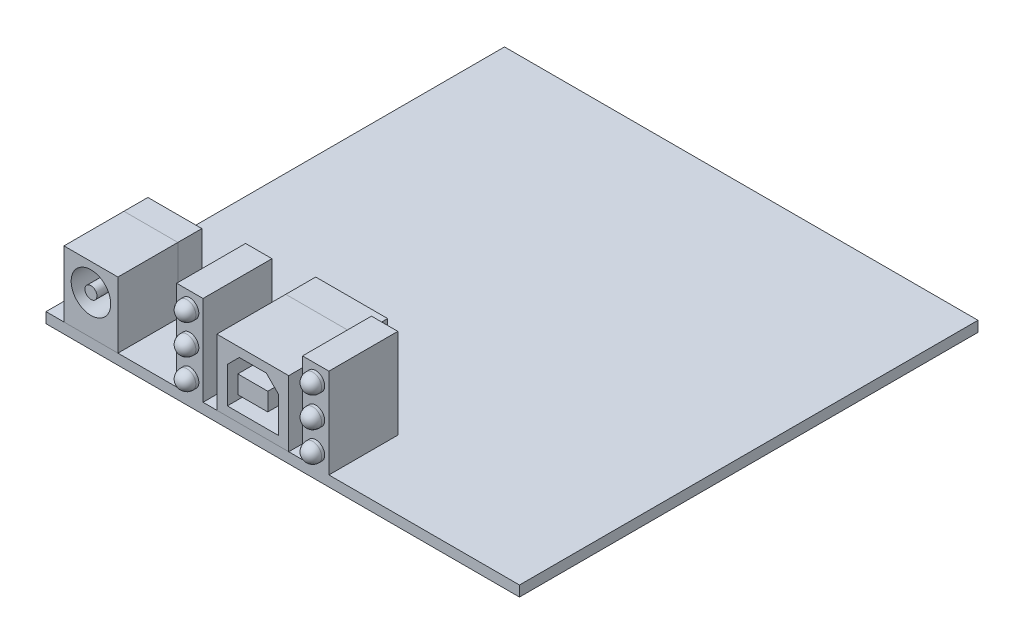
from build123d import *

# Parameters (mm, degrees)
SKETCH1_W             = 79
SKETCH1_H             = 76.5
BOSS_EXTRUDE1_DEPTH   = 1.75
SKETCH2_W             = 9
SKETCH2_H             = 11
SKETCH2_R             = 3.3
BOSS_EXTRUDE2_DEPTH   = 10
SKETCH2_R_2           = 1
BOSS_EXTRUDE2_2_DEPTH = 10
SKETCH3_W             = 9
SKETCH3_H             = 11
BOSS_EXTRUDE3_DEPTH   = 4
SKETCH4_W             = 12
SKETCH4_H             = 11
BOSS_EXTRUDE4_DEPTH   = 11.5
SKETCH4_W_2           = 4.4
SKETCH4_H_2           = 15
BOSS_EXTRUDE4_2_DEPTH = 11.5
BOSS_EXTRUDE4_3_DEPTH = 11.5
SKETCH4_W_3           = 5
SKETCH4_H_3           = 3
BOSS_EXTRUDE4_4_DEPTH = 11.5
SKETCH5_W             = 12
SKETCH5_H             = 11
BOSS_EXTRUDE5_DEPTH   = 5
SKETCH6_R             = 1.5
BOSS_EXTRUDE6_DEPTH   = 2
FILLET1_R             = 1.5


with BuildPart() as part:
    # Sketch1 → Boss-Extrude1 (new body)
    with BuildSketch(Plane(origin=(0, 0, 0), x_dir=(1, 0, 0), z_dir=(0, 1, 0))):
        Rectangle(SKETCH1_W, SKETCH1_H)
    extrude(amount=BOSS_EXTRUDE1_DEPTH)



with BuildPart() as body_2:
    # Sketch2 → Boss-Extrude2 (new body)
    with BuildSketch(Plane.XY.offset(38.25)):
        with Locations((-32, 7.25)):
            Rectangle(SKETCH2_W, SKETCH2_H)
        with Locations((-32, 8.25)):
            Circle(SKETCH2_R, mode=Mode.SUBTRACT)
    extrude(amount=-BOSS_EXTRUDE2_DEPTH)


with BuildPart() as body_3:
    # Sketch2 → Boss-Extrude2 2 (new body)
    with BuildSketch(Plane.XY.offset(38.25)):
        with Locations((-32, 8.25)):
            Circle(SKETCH2_R_2)
    extrude(amount=-BOSS_EXTRUDE2_2_DEPTH)


with BuildPart() as part_1:
    add(part.part)

    add(body_3.part)  # Boss-Extrude3 merges body 3
    # Sketch3 → Boss-Extrude3 (add)
    with BuildSketch(Plane(origin=(0, 0, 28.25), x_dir=(-1, 0, 0), z_dir=(0, 0, -1))):
        with Locations((32, 7.25)):
            Rectangle(SKETCH3_W, SKETCH3_H)
    extrude(amount=BOSS_EXTRUDE3_DEPTH)



with BuildPart() as body_3_2:
    # Sketch4 → Boss-Extrude4 (new body)
    with BuildSketch(Plane.XY.offset(38.25)):
        with Locations((-5, 7.25)):
            Rectangle(SKETCH4_W, SKETCH4_H)
        Polygon((-9.25, 3.25), (-9.25, 9.25), (-7.25, 11.25), (-2.75, 11.25), (-0.75, 9.25), (-0.75, 3.25), align=None, mode=Mode.SUBTRACT)
    extrude(amount=-BOSS_EXTRUDE4_DEPTH)


with BuildPart() as body_4:
    # Sketch4 → Boss-Extrude4 2 (new body)
    with BuildSketch(Plane.XY.offset(38.25)):
        with Locations((-15.5, 9.25)):
            Rectangle(SKETCH4_W_2, SKETCH4_H_2)
    extrude(amount=-BOSS_EXTRUDE4_2_DEPTH)


with BuildPart() as body_5:
    # Sketch4 → Boss-Extrude4 3 (new body)
    with BuildSketch(Plane.XY.offset(38.25)):
        with Locations((5.5, 9.25)):
            Rectangle(SKETCH4_W_2, SKETCH4_H_2)
    extrude(amount=-BOSS_EXTRUDE4_3_DEPTH)


with BuildPart() as body_6:
    # Sketch4 → Boss-Extrude4 4 (new body)
    with BuildSketch(Plane.XY.offset(38.25)):
        with Locations((-5, 7.25)):
            Rectangle(SKETCH4_W_3, SKETCH4_H_3)
    extrude(amount=-BOSS_EXTRUDE4_4_DEPTH)


with BuildPart() as body_7:
    # Sketch5 → Boss-Extrude5 (new body)
    with BuildSketch(Plane(origin=(0, 0, 26.75), x_dir=(-1, 0, 0), z_dir=(0, 0, -1))):
        with Locations((5, 7.25)):
            Rectangle(SKETCH5_W, SKETCH5_H)
    extrude(amount=BOSS_EXTRUDE5_DEPTH)


with BuildPart() as part_2:
    add(part_1.part)

    add(body_5.part)  # Boss-Extrude6 merges body 5

    add(body_4.part)  # Boss-Extrude6 merges body 4
    # Sketch6 → Boss-Extrude6 (add)
    with BuildSketch(Plane.XY.offset(38.25)):
        with Locations(Location((-15.5, 9.25, 0), (0, 0, 180))):
            Circle(SKETCH6_R)
        with Locations(Location((5.5, 9.25, 0), (0, 0, 180))):
            Circle(SKETCH6_R)
        with Locations(Location((-15.5, 4.25, 0), (0, 0, 180))):
            Circle(SKETCH6_R)
        with Locations(Location((5.5, 4.25, 0), (0, 0, 180))):
            Circle(SKETCH6_R)
        with Locations(Location((-15.5, 14.25, 0), (0, 0, 180))):
            Circle(SKETCH6_R)
        with Locations(Location((5.5, 14.25, 0), (0, 0, 180))):
            Circle(SKETCH6_R)
    extrude(amount=BOSS_EXTRUDE6_DEPTH)

    # Fillet1
    fillet1_edges = [part_2.edges().sort_by_distance(p)[0] for p in [
        (-14, 9.25, 40.25),
        (7, 9.25, 40.25),
        (-14, 4.25, 40.25),
        (7, 4.25, 40.25),
        (-14, 14.25, 40.25),
        (7, 14.25, 40.25),
    ]]
    fillet(fillet1_edges, radius=FILLET1_R)


solid = Compound([body_2.part, body_3_2.part, body_6.part, body_7.part, part_2.part])
